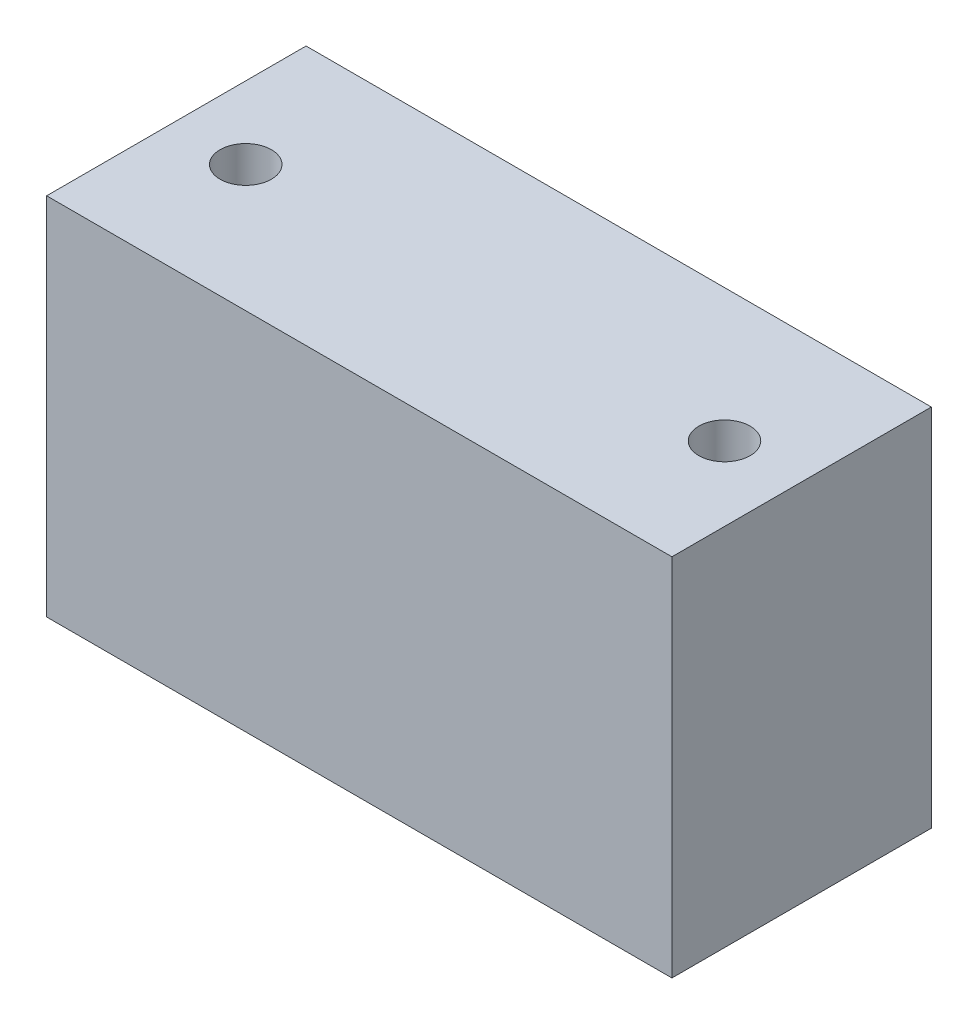
from build123d import *

# Parameters (mm, degrees)
CROQUIS1_W              = 54.853089678
CROQUIS1_H              = 22.758817794
SALIENTE_EXTRUIR1_DEPTH = 32
CROQUIS2_R              = 2.25
CORTAR_EXTRUIR1_DEPTH   = 82.454560552


with BuildPart() as part:
    # Croquis1 → Saliente-Extruir1 (new body)
    with BuildSketch(Plane(origin=(0, 0, 0), x_dir=(1, 0, 0), z_dir=(0, 1, 0))):
        with Locations((44.92185013, 8.025620867)):
            Rectangle(CROQUIS1_W, CROQUIS1_H)
    extrude(amount=SALIENTE_EXTRUIR1_DEPTH)

    # Croquis2 → Cortar-Extruir1 (cut, through all)
    with BuildSketch(Plane(origin=(0, 32, 0), x_dir=(1, 0, 0), z_dir=(0, 1, 0))):
        with Locations(Location((23.848394969, 7.757419581, 0), (0, 0, 270))):
            Circle(CROQUIS2_R)
        with Locations(Location((65.848394969, 7.757419581, 0), (0, 0, 270))):
            Circle(CROQUIS2_R)
    extrude(amount=-CORTAR_EXTRUIR1_DEPTH, mode=Mode.SUBTRACT)


solid = part.part
